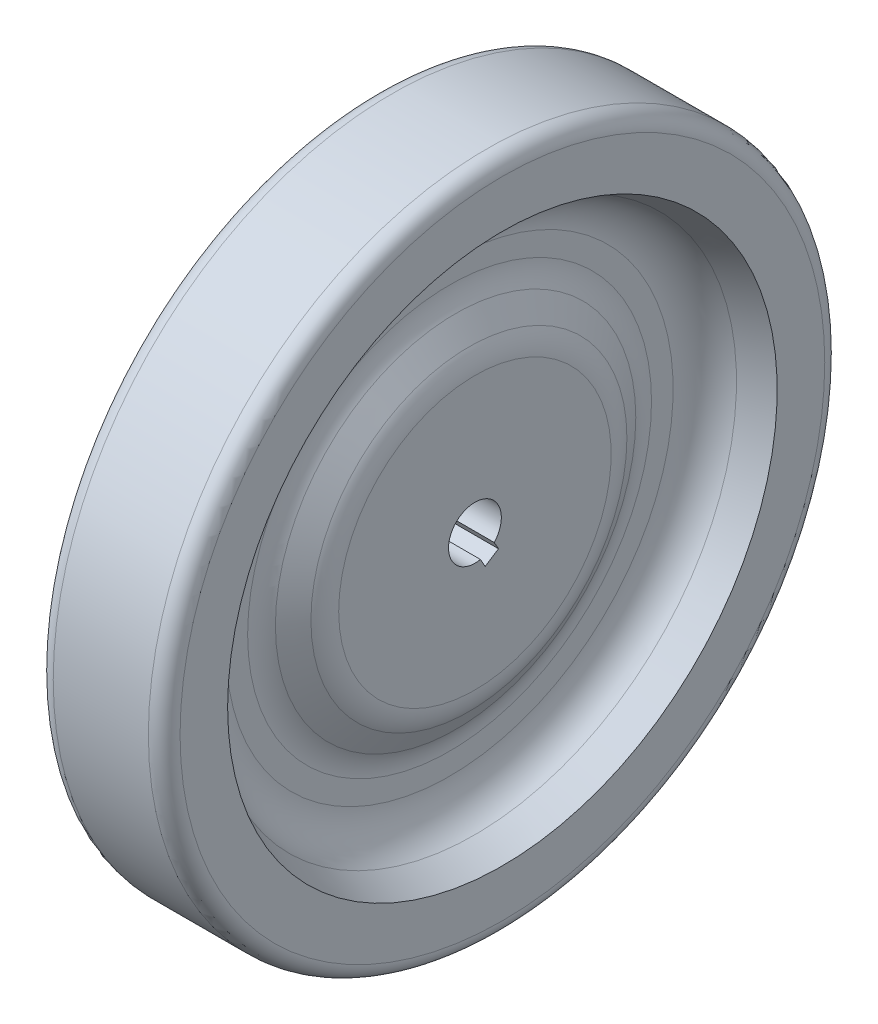
from build123d import *

# Parameters (mm, degrees)
CUT_EXTRUDE1_DEPTH      = 147.750959265
CUT_EXTRUDE1_DEPTH_BACK = 147.750959265


with BuildPart() as part:
    # Sketch1 → Revolve1 (revolve)
    with BuildSketch(Plane.XY, mode=Mode.PRIVATE) as revolve1_sk:
        with BuildLine():
            Line((-10.795, 0), (-10.795, 40.932303645))
            ThreePointArc((-10.795, 40.932303645), (-10.334179588, 44.322360135), (-8.985160157, 47.466399739))
            Line((-8.985160157, 47.466399739), (-4.984839843, 54.133600261))
            ThreePointArc((-4.984839843, 54.133600261), (-3.635820412, 57.277639865), (-3.175, 60.667696355))
            Line((-3.175, 60.667696355), (-3.175, 67.170867113))
            ThreePointArc((-3.175, 67.170867113), (-5.202068626, 74.054073915), (-10.636186753, 78.74))
            Line((-10.636186753, 78.74), (-19.05, 82.55))
            Line((-19.05, 82.55), (-19.05, 96.8375))
            ThreePointArc((-19.05, 96.8375), (-17.655096045, 100.205096045), (-14.2875, 101.6))
            Line((-14.2875, 101.6), (14.2875, 101.6))
            ThreePointArc((14.2875, 101.6), (17.655096045, 100.205096045), (19.05, 96.8375))
            Line((19.05, 96.8375), (19.05, 82.55))
            Line((19.05, 82.55), (10.636186753, 78.74))
            ThreePointArc((10.636186753, 78.74), (5.202068626, 74.054073915), (3.175, 67.170867113))
            Line((3.175, 67.170867113), (3.175, 60.667696355))
            ThreePointArc((3.175, 60.667696355), (3.635820412, 57.277639865), (4.984839843, 54.133600261))
            Line((4.984839843, 54.133600261), (8.985160157, 47.466399739))
            ThreePointArc((8.985160157, 47.466399739), (10.334179588, 44.322360135), (10.795, 40.932303645))
            Line((10.795, 40.932303645), (10.795, 0))
            Line((10.795, 0), (-10.795, 0))
        make_face()
    revolve(revolve1_sk.sketch.rotate(Axis((-10.795, 0, 0), (1, 0, 0)), 90), axis=Axis((-10.795, 0, 0), (1, 0, 0)))

    # Sketch2 → Cut-Extrude1 (cut, two sides: drawn at the far end of the back side and taken through both)
    with BuildSketch(Plane.ZY.offset(10.795).offset(-CUT_EXTRUDE1_DEPTH_BACK)):
        with BuildLine():
            Line((-7.079276607, -7.710444497), (-3.072643811, -10.301240032))
            Line((-3.072643811, -10.301240032), (-1.643427642, -7.765503965))
            ThreePointArc((-1.643427642, -7.765503965), (3.897381242, 6.914790359), (-5.792301857, -5.42707522))
            Line((-5.792301857, -5.42707522), (-7.079276607, -7.710444497))
        make_face()
    extrude(amount=CUT_EXTRUDE1_DEPTH + CUT_EXTRUDE1_DEPTH_BACK, mode=Mode.SUBTRACT)


solid = part.part
